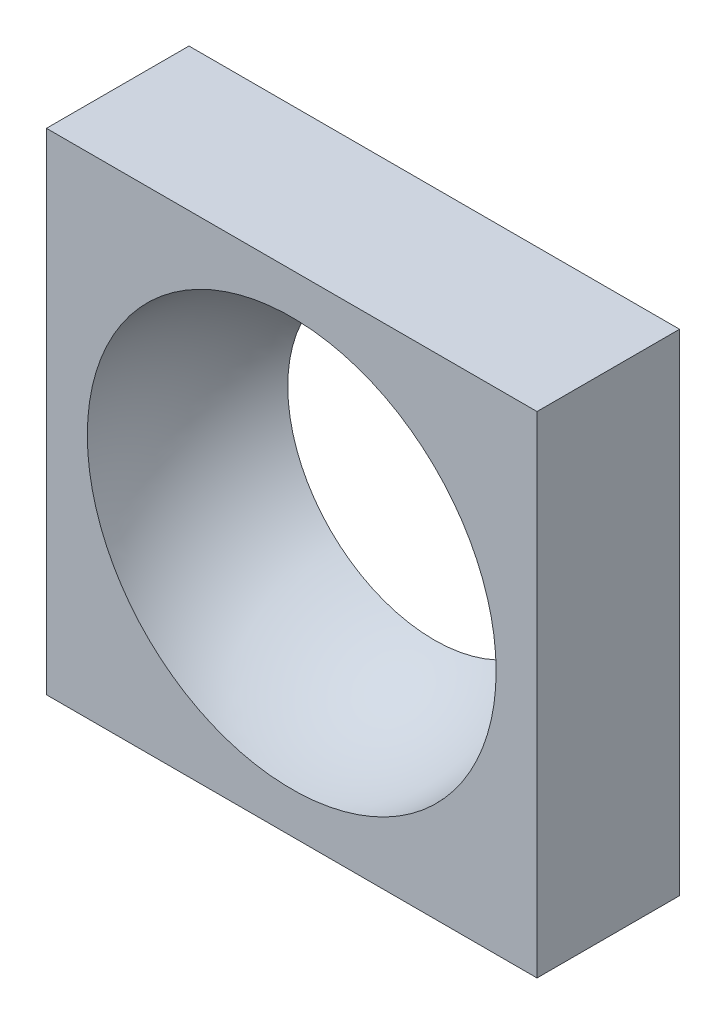
from build123d import *

# Parameters (mm, degrees)
SKETCH2_W           = 24
SKETCH2_H           = 24
BOSS_EXTRUDE1_DEPTH = 12
CUT_EXTRUDE1_DEPTH  = 37


with BuildPart() as part:
    # Sketch2 → Boss-Extrude1 (new body)
    with BuildSketch(Plane.XY):
        with Locations((12, 12)):
            Rectangle(SKETCH2_W, SKETCH2_H)
    extrude(amount=BOSS_EXTRUDE1_DEPTH)

    # Sketch4 → Cut-Revolve1 (revolve, cut)
    with BuildSketch(Plane.XY.offset(12)):
        with BuildLine():
            Line((12, 22), (12, 2))
            ThreePointArc((12, 2), (2, 12), (12, 22))
        make_face()
    revolve(axis=Axis((12, 22, 12), (0, -1, 0)), mode=Mode.SUBTRACT)

    # Sketch6 → Cut-Extrude1 (cut, through all)
    with BuildSketch(Plane(origin=(24, 0, 0), x_dir=(0, 0, -1), z_dir=(1, 0, 0))):
        Polygon((0, 24), (-3.026616613, 24), (-5.026616613, 24), (-5.026616613, 0), (-3.026616613, 0), (0, 0), align=None)
    extrude(amount=-CUT_EXTRUDE1_DEPTH, mode=Mode.SUBTRACT)


solid = part.part
